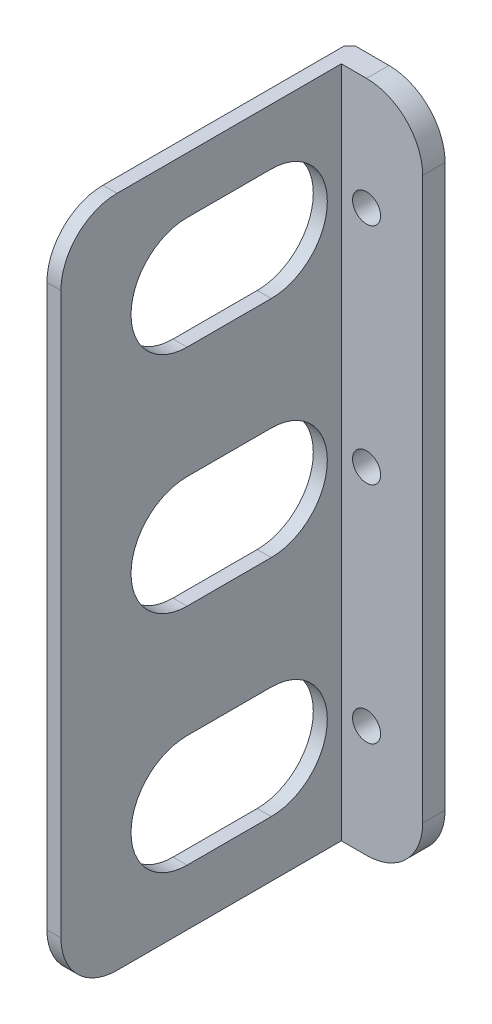
from build123d import *

# Parameters (mm, degrees)
SKETCH_1_W          = 17
SKETCH_1_H          = 120
SKETCH_1_R          = 2.5
EXTRUDE_1_DEPTH     = 4
SKETCH_1_3_W        = 2.5
SKETCH_1_3_H        = 120
EXTRUDE_2_DEPTH     = 50
FILLET_1_R          = 10
CUT_EXTRUDE_1_DEPTH = 50
CHAMFER_1_SIZE      = 1


with BuildPart() as part:
    # 스케치1 → 보스-돌출1 (new body)
    with BuildSketch(Plane.XY):
        with Locations((1.5, 0)):
            Rectangle(SKETCH_1_W, SKETCH_1_H)
        with Locations((0, 40)):
            Circle(SKETCH_1_R, mode=Mode.SUBTRACT)
        with Locations((0, -40)):
            Circle(SKETCH_1_R, mode=Mode.SUBTRACT)
        Circle(SKETCH_1_R, mode=Mode.SUBTRACT)
    extrude(amount=-EXTRUDE_1_DEPTH)

    # 스케치1<3> → 보스-돌출2 (add)
    with BuildSketch(Plane.XY):
        with Locations((-5.75, 0)):
            Rectangle(SKETCH_1_3_W, SKETCH_1_3_H)
    extrude(amount=EXTRUDE_2_DEPTH)

    # 필렛1
    fillet_1_edges = [part.edges().sort_by_distance(p)[0] for p in [
        (10, -60, -2),
        (10, 60, -2),
        (-5.75, 60, 50),
        (-5.75, -60, 50),
    ]]
    fillet(fillet_1_edges, radius=FILLET_1_R)

    # 스케치2 → 컷-돌출1 (cut)
    with BuildSketch(Plane(origin=(-4.5, 0, 0), x_dir=(0, 0, -1), z_dir=(1, 0, 0))):
        with BuildLine():
            Line((-12.5, -50), (-27.5, -50))
            ThreePointArc((-27.5, -50), (-37.5, -40), (-27.5, -30))
            Line((-27.5, -30), (-12.5, -30))
            ThreePointArc((-12.5, -30), (-2.5, -40), (-12.5, -50))
        make_face()
        with BuildLine():
            Line((-12.5, -10), (-27.5, -10))
            ThreePointArc((-27.5, -10), (-37.5, 0), (-27.5, 10))
            Line((-27.5, 10), (-12.5, 10))
            ThreePointArc((-12.5, 10), (-2.5, 0), (-12.5, -10))
        make_face()
        with BuildLine():
            Line((-12.5, 30), (-27.5, 30))
            ThreePointArc((-27.5, 30), (-37.5, 40), (-27.5, 50))
            Line((-27.5, 50), (-12.5, 50))
            ThreePointArc((-12.5, 50), (-2.5, 40), (-12.5, 30))
        make_face()
    extrude(amount=-CUT_EXTRUDE_1_DEPTH, mode=Mode.SUBTRACT)

    # 모따기1
    chamfer_1_edges = [part.edges().sort_by_distance(p)[0] for p in [
        (-7, 0, -4),
    ]]
    chamfer(chamfer_1_edges, length=CHAMFER_1_SIZE)


solid = part.part
